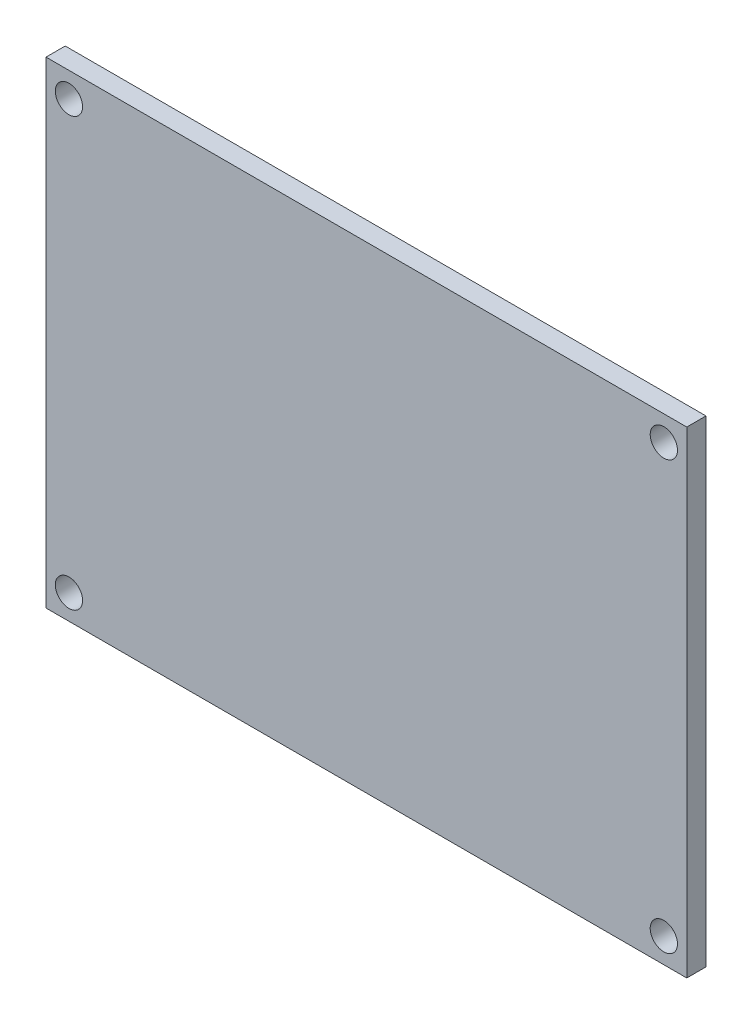
from build123d import *

# Parameters (mm, degrees)
SKETCH1_W           = 51.7
SKETCH1_H           = 38.5
BOSS_EXTRUDE1_DEPTH = 1.55
CUT_EXTRUDE1_REACH  = 34.267
SKETCH2_R           = 1.1


with BuildPart() as part:
    # Sketch1 → Boss-Extrude1 (new body)
    with BuildSketch(Plane.XY):
        Rectangle(SKETCH1_W, SKETCH1_H)
    extrude(amount=BOSS_EXTRUDE1_DEPTH)

    # Sketch2 → Cut-Extrude1 (cut, up to next)
    with BuildSketch(Plane.XY.offset(1.55), mode=Mode.PRIVATE) as cut_extrude1_sk1:
        with Locations((-24, 17.25)):
            Circle(SKETCH2_R)
    cut_extrude1_tool1 = extrude(cut_extrude1_sk1.sketch, amount=-CUT_EXTRUDE1_REACH, mode=Mode.PRIVATE) & part.part
    # Sketch2 → Cut-Extrude1 (cut, up to next)
    with BuildSketch(Plane.XY.offset(1.55), mode=Mode.PRIVATE) as cut_extrude1_sk2:
        with Locations((24, 17.25)):
            Circle(SKETCH2_R)
    cut_extrude1_tool2 = extrude(cut_extrude1_sk2.sketch, amount=-CUT_EXTRUDE1_REACH, mode=Mode.PRIVATE) & part.part
    # Sketch2 → Cut-Extrude1 (cut, up to next)
    with BuildSketch(Plane.XY.offset(1.55), mode=Mode.PRIVATE) as cut_extrude1_sk3:
        with Locations((24, -17.25)):
            Circle(SKETCH2_R)
    cut_extrude1_tool3 = extrude(cut_extrude1_sk3.sketch, amount=-CUT_EXTRUDE1_REACH, mode=Mode.PRIVATE) & part.part
    # Sketch2 → Cut-Extrude1 (cut, up to next)
    with BuildSketch(Plane.XY.offset(1.55), mode=Mode.PRIVATE) as cut_extrude1_sk4:
        with Locations((-24, -17.25)):
            Circle(SKETCH2_R)
    cut_extrude1_tool4 = extrude(cut_extrude1_sk4.sketch, amount=-CUT_EXTRUDE1_REACH, mode=Mode.PRIVATE) & part.part
    add(cut_extrude1_tool1.solids().sort_by_distance((-24, 17.25, 1.55))[0], mode=Mode.SUBTRACT)
    add(cut_extrude1_tool2.solids().sort_by_distance((24, 17.25, 1.55))[0], mode=Mode.SUBTRACT)
    add(cut_extrude1_tool3.solids().sort_by_distance((24, -17.25, 1.55))[0], mode=Mode.SUBTRACT)
    add(cut_extrude1_tool4.solids().sort_by_distance((-24, -17.25, 1.55))[0], mode=Mode.SUBTRACT)


solid = part.part
